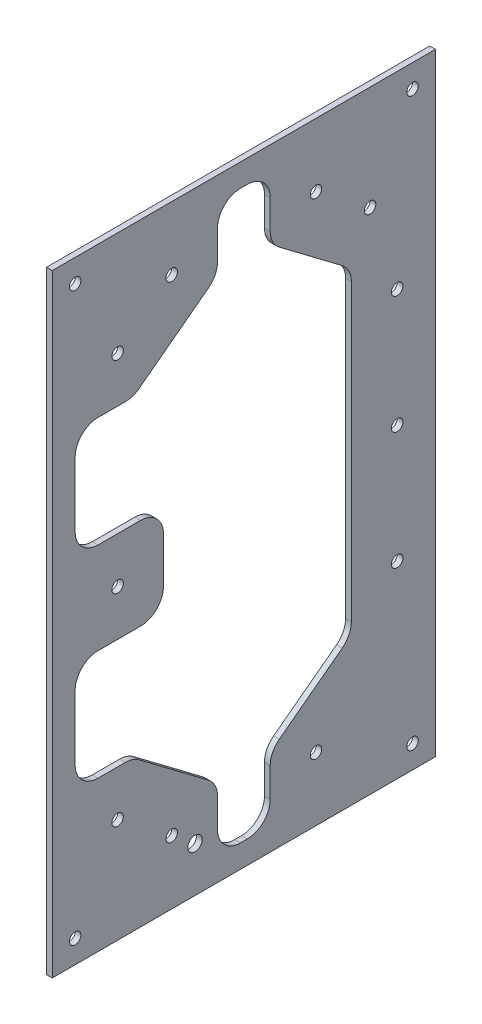
from build123d import *

# Parameters (mm, degrees)
SKETCH1_W           = 212.5
SKETCH1_H           = 339.725
SKETCH1_R           = 3.175
BOSS_EXTRUDE1_DEPTH = 3.175
CUT_EXTRUDE1_DEPTH  = 401.72360331
SKETCH3_R           = 4
CUT_EXTRUDE2_DEPTH  = 13.97


with BuildPart() as part:
    # Sketch1 → Boss-Extrude1 (new body)
    with BuildSketch(Plane(origin=(0, 0, 0), x_dir=(0, 0, -1), z_dir=(1, 0, 0))):
        with Locations((106.25, -169.8625)):
            Rectangle(SKETCH1_W, SKETCH1_H)
        with Locations((12.7, -12.7)):
            Circle(SKETCH1_R, mode=Mode.SUBTRACT)
        with Locations((199.8, -12.7)):
            Circle(SKETCH1_R, mode=Mode.SUBTRACT)
        with Locations((66.25, -35.2425)):
            Circle(SKETCH1_R, mode=Mode.SUBTRACT)
        with Locations((146.25, -35.2425)):
            Circle(SKETCH1_R, mode=Mode.SUBTRACT)
        with Locations((176.25, -57.8625)):
            Circle(SKETCH1_R, mode=Mode.SUBTRACT)
        with Locations((36.25, -57.8625)):
            Circle(SKETCH1_R, mode=Mode.SUBTRACT)
        with Locations((191.25, -104.5325)):
            Circle(SKETCH1_R, mode=Mode.SUBTRACT)
        with Locations((36.25, -169.8625)):
            Circle(SKETCH1_R, mode=Mode.SUBTRACT)
        with Locations((191.25, -169.8625)):
            Circle(SKETCH1_R, mode=Mode.SUBTRACT)
        with Locations((36.25, -281.8625)):
            Circle(SKETCH1_R, mode=Mode.SUBTRACT)
        with Locations((66.25, -304.4825)):
            Circle(SKETCH1_R, mode=Mode.SUBTRACT)
        with Locations((12.7, -327.025)):
            Circle(SKETCH1_R, mode=Mode.SUBTRACT)
        with Locations((199.8, -327.025)):
            Circle(SKETCH1_R, mode=Mode.SUBTRACT)
        with Locations((146.25, -304.4825)):
            Circle(SKETCH1_R, mode=Mode.SUBTRACT)
        with Locations(Location((191.25, -235.1925, 0), (0, 0, 180))):
            Circle(SKETCH1_R, mode=Mode.SUBTRACT)
    extrude(amount=BOSS_EXTRUDE1_DEPTH)

    # Sketch2 → Cut-Extrude1 (cut, through all)
    with BuildSketch(Plane(origin=(3.175, 0, 0), x_dir=(0, 0, -1), z_dir=(1, 0, 0))):
        with BuildLine():
            Line((165.85, -88.161695758), (165.85, -251.563304242))
            ThreePointArc((165.85, -251.563304242), (164.516472011, -257.22840036), (160.795934799, -261.703801323))
            Line((160.795934799, -261.703801323), (125.904065201, -288.012271))
            ThreePointArc((125.904065201, -288.012271), (122.183527989, -292.487671963), (120.85, -298.152768081))
            Line((120.85, -298.152768081), (120.85, -314.325))
            ThreePointArc((120.85, -314.325), (117.130256121, -323.305256121), (108.15, -327.025))
            Line((108.15, -327.025), (104.35, -327.025))
            ThreePointArc((104.35, -327.025), (95.369743879, -323.305256121), (91.65, -314.325))
            Line((91.65, -314.325), (91.65, -298.152768081))
            ThreePointArc((91.65, -298.152768081), (90.316472011, -292.487671963), (86.595934799, -288.012271))
            Line((86.595934799, -288.012271), (48.147303392, -259.022002919))
            ThreePointArc((48.147303392, -259.022002919), (44.532850149, -257.119362682), (40.501368593, -256.4625))
            Line((40.501368593, -256.4625), (25.4, -256.4625))
            ThreePointArc((25.4, -256.4625), (16.419743879, -252.742756121), (12.7, -243.7625))
            Line((12.7, -243.7625), (12.7, -207.9625))
            ThreePointArc((12.7, -207.9625), (16.419743879, -198.982243879), (25.4, -195.2625))
            Line((25.4, -195.2625), (48.95, -195.2625))
            ThreePointArc((48.95, -195.2625), (57.930256121, -191.542756121), (61.65, -182.5625))
            Line((61.65, -182.5625), (61.65, -157.1625))
            ThreePointArc((61.65, -157.1625), (57.930256121, -148.182243879), (48.95, -144.4625))
            Line((48.95, -144.4625), (25.4, -144.4625))
            ThreePointArc((25.4, -144.4625), (16.419743879, -140.742756121), (12.7, -131.7625))
            Line((12.7, -131.7625), (12.7, -95.9625))
            ThreePointArc((12.7, -95.9625), (16.419743879, -86.982243879), (25.4, -83.2625))
            Line((25.4, -83.2625), (40.501368593, -83.2625))
            ThreePointArc((40.501368593, -83.2625), (44.532850149, -82.605637318), (48.147303392, -80.702997081))
            Line((48.147303392, -80.702997081), (86.595934799, -51.712729))
            ThreePointArc((86.595934799, -51.712729), (90.316472011, -47.237328037), (91.65, -41.572231919))
            Line((91.65, -41.572231919), (91.65, -25.4))
            ThreePointArc((91.65, -25.4), (95.369743879, -16.419743879), (104.35, -12.7))
            Line((104.35, -12.7), (108.15, -12.7))
            ThreePointArc((108.15, -12.7), (117.130256121, -16.419743879), (120.85, -25.4))
            Line((120.85, -25.4), (120.85, -41.572231919))
            ThreePointArc((120.85, -41.572231919), (122.183527989, -47.237328037), (125.904065201, -51.712729))
            Line((125.904065201, -51.712729), (160.795934799, -78.021198677))
            ThreePointArc((160.795934799, -78.021198677), (164.516472011, -82.49659964), (165.85, -88.161695758))
        make_face()
    extrude(amount=-CUT_EXTRUDE1_DEPTH, mode=Mode.SUBTRACT)

    # Sketch3 → Cut-Extrude2 (cut)
    with BuildSketch(Plane.ZY):
        with Locations((-79.15, -314.725)):
            Circle(SKETCH3_R)
    extrude(amount=-CUT_EXTRUDE2_DEPTH, mode=Mode.SUBTRACT)


solid = part.part
